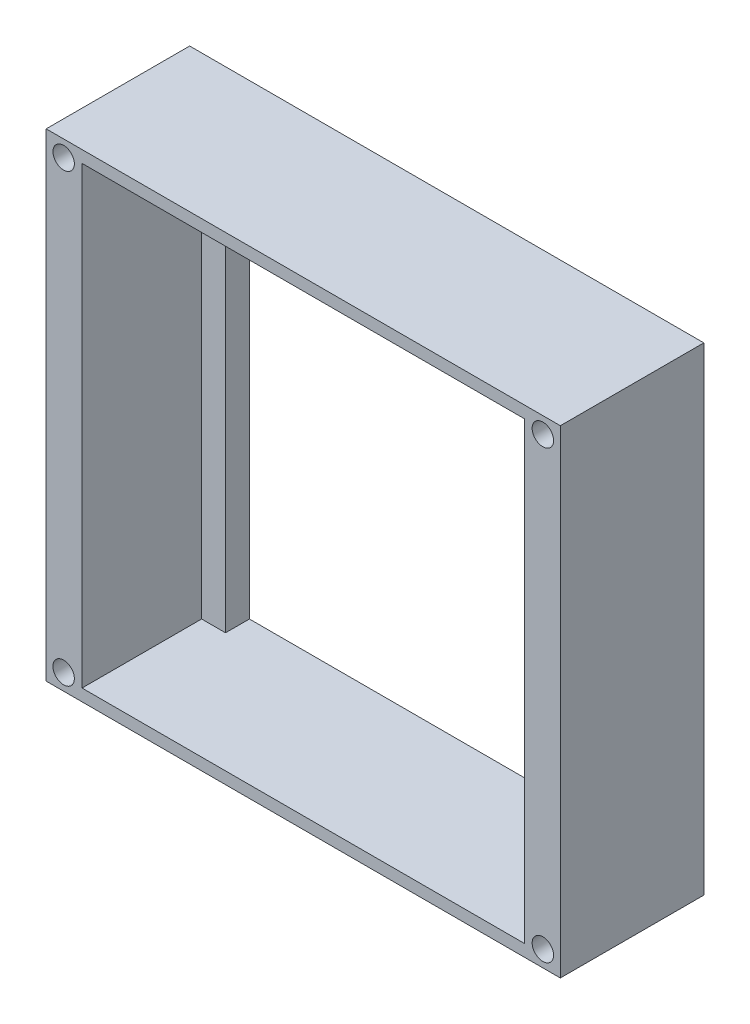
from build123d import *

# Parameters (mm, degrees)
SKETCH2_W           = 136.525
SKETCH2_H           = 127
BOSS_EXTRUDE1_DEPTH = 38.1
SKETCH3_W           = 117.475
SKETCH3_H           = 120.65
CUT_EXTRUDE2_DEPTH  = 31.75
SKETCH4_W           = 104.775
SKETCH4_H           = 120.65
CUT_EXTRUDE3_DEPTH  = 38.1
SKETCH5_R           = 2.8448
CUT_EXTRUDE4_DEPTH  = 25.4


with BuildPart() as part:
    # Sketch2 → Boss-Extrude1 (new body)
    with BuildSketch(Plane.XY):
        Rectangle(SKETCH2_W, SKETCH2_H)
    extrude(amount=-BOSS_EXTRUDE1_DEPTH)

    # Sketch3 → Cut-Extrude2 (cut)
    with BuildSketch(Plane.XY):
        Rectangle(SKETCH3_W, SKETCH3_H)
    extrude(amount=-CUT_EXTRUDE2_DEPTH, mode=Mode.SUBTRACT)

    # Sketch4 → Cut-Extrude3 (cut)
    with BuildSketch(Plane(origin=(0, 0, -38.1), x_dir=(-1, 0, 0), z_dir=(0, 0, -1))):
        Rectangle(SKETCH4_W, SKETCH4_H)
    extrude(amount=-CUT_EXTRUDE3_DEPTH, mode=Mode.SUBTRACT)

    # Sketch5 → Cut-Extrude4 (cut)
    with BuildSketch(Plane.XY):
        with Locations((-63.62065, 59.182)):
            Circle(SKETCH5_R)
        with Locations(Location((63.62065, 59.182, 0), (0, 0, 180))):
            Circle(SKETCH5_R)
        with Locations((63.62065, -59.182)):
            Circle(SKETCH5_R)
        with Locations(Location((-63.62065, -59.182, 0), (0, 0, 180))):
            Circle(SKETCH5_R)
    extrude(amount=-CUT_EXTRUDE4_DEPTH, mode=Mode.SUBTRACT)


solid = part.part
